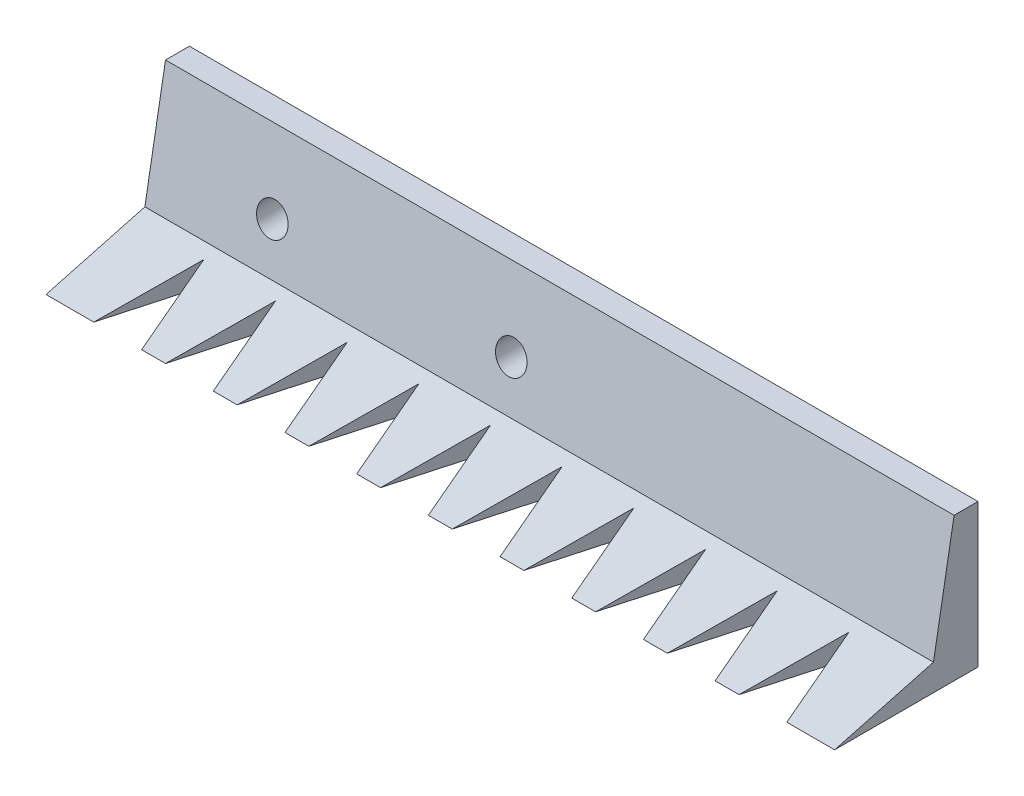
from build123d import *

# Parameters (mm, degrees)
BOSS_EXTRUDE1_DEPTH  = 100
M3_CLEARANCE_HOLE1_D = 3.4
SKETCH4_R            = 3.25
CUT_EXTRUDE1_DEPTH   = 108.964114408
BOSS_EXTRUDE2_DEPTH  = 65
CUT_EXTRUDE2_DEPTH   = 171.367250374
LPATTERN1_COUNT      = 10
LPATTERN1_PITCH      = 15


with BuildPart() as part:
    # Sketch1 → Boss-Extrude1 (new body)
    with BuildSketch(Plane(origin=(0, 0, 0), x_dir=(0, 0, -1), z_dir=(1, 0, 0))):
        Polygon((0, 0), (0, 30), (-5, 30), (-9.312388631, 5.54322876), (-30, 0), align=None)
    extrude(amount=BOSS_EXTRUDE1_DEPTH)

    # M3 Clearance Hole1 (through all)
    with Locations(Plane(origin=(0, 0, 0), x_dir=(-1, 0, 0), z_dir=(0, 0, -1))):
        with Locations((-25, 15), (-75, 15)):
            Hole(M3_CLEARANCE_HOLE1_D / 2)

    # Sketch4 → Cut-Extrude1 (cut, through all)
    with BuildSketch(Plane(origin=(0, 0, 2.5), x_dir=(-1, 0, 0), z_dir=(0, 0, -1))):
        with Locations((-75, 15)):
            Circle(SKETCH4_R)
        with Locations((-25, 15)):
            Circle(SKETCH4_R)
    extrude(amount=-CUT_EXTRUDE1_DEPTH, mode=Mode.SUBTRACT)

    # Sketch6 → Boss-Extrude2 (add)
    with BuildSketch(Plane.ZY.offset(-100)):
        Polygon((0, 0), (30, 0), (9.312388631, 5.54322876), (5, 30), (0, 30), align=None)
    extrude(amount=-BOSS_EXTRUDE2_DEPTH)

    # Sketch8 → Cut-Extrude2 (cut, symmetric)
    with BuildSketch(Plane(origin=(0, 0, 0), x_dir=(1, 0, 0), z_dir=(0, 1, 0))):
        Polygon((10, -30), (15, -12), (20, -30), align=None)
    cut_extrude2 = extrude(amount=CUT_EXTRUDE2_DEPTH, both=True, mode=Mode.SUBTRACT)

    # LPattern1: Cut-Extrude2 ×10
    with Locations(*[(i * LPATTERN1_PITCH, 0, 0) for i in range(1, LPATTERN1_COUNT)]):
        add(cut_extrude2, mode=Mode.SUBTRACT)


solid = part.part
